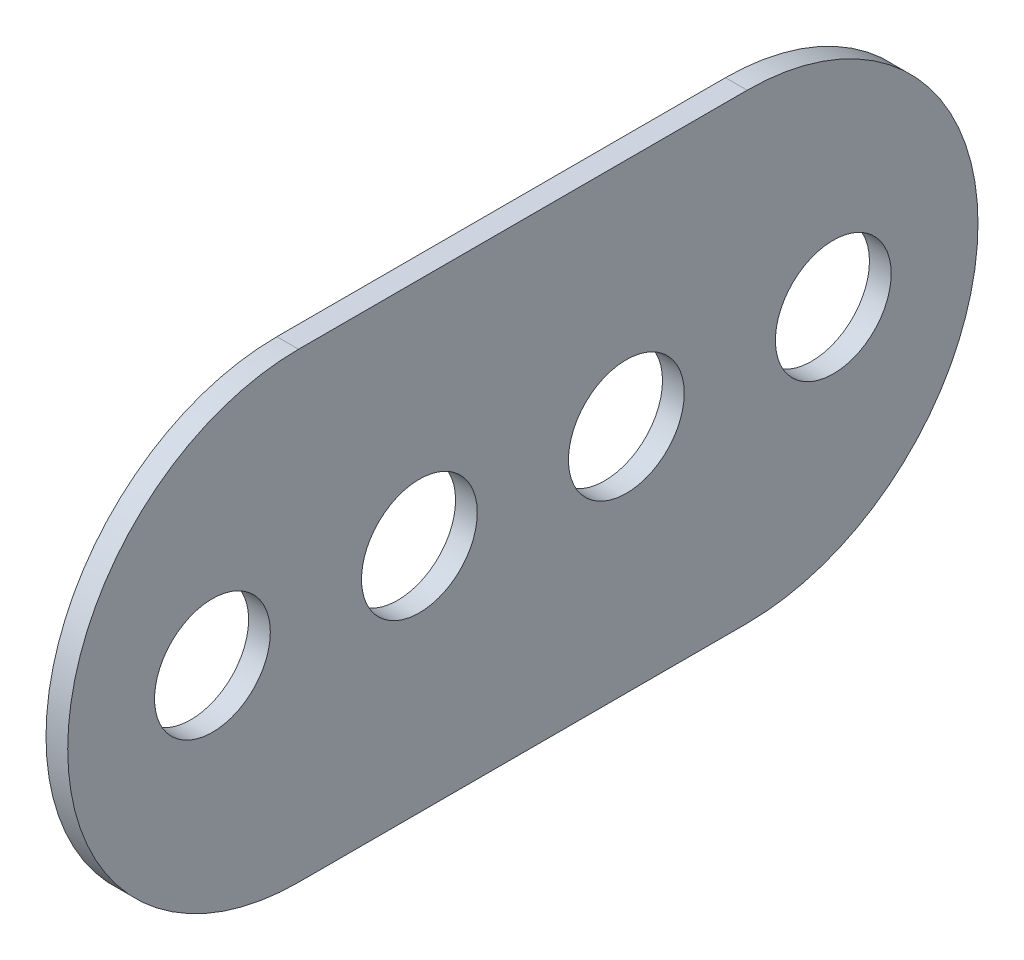
from build123d import *

# Parameters (mm, degrees)
BOSS_EXTRUDE1_DEPTH = 1.5
SKETCH2_R           = 8
CUT_EXTRUDE1_DEPTH  = 71.590509277


with BuildPart() as part:
    # Sketch1 → Boss-Extrude1 (new, symmetric)
    with BuildSketch(Plane(origin=(0, 0, 0), x_dir=(0, 0, -1), z_dir=(1, 0, 0))):
        with BuildLine():
            Line((-31, 31.9), (31, 31.9))
            ThreePointArc((31, 31.9), (62.9, 0), (31, -31.9))
            Line((31, -31.9), (-31, -31.9))
            ThreePointArc((-31, -31.9), (-62.9, 0), (-31, 31.9))
        make_face()
    extrude(amount=BOSS_EXTRUDE1_DEPTH, both=True)

    # Sketch2 → Cut-Extrude1 (cut, through all)
    with BuildSketch(Plane(origin=(1.5, 0, 0), x_dir=(0, 0, -1), z_dir=(1, 0, 0))):
        with Locations((-14.3, 0)):
            Circle(SKETCH2_R)
        with Locations((-42.9, 0)):
            Circle(SKETCH2_R)
        with Locations((42.9, 0)):
            Circle(SKETCH2_R)
        with Locations((14.3, 0)):
            Circle(SKETCH2_R)
    extrude(amount=-CUT_EXTRUDE1_DEPTH, mode=Mode.SUBTRACT)


solid = part.part
